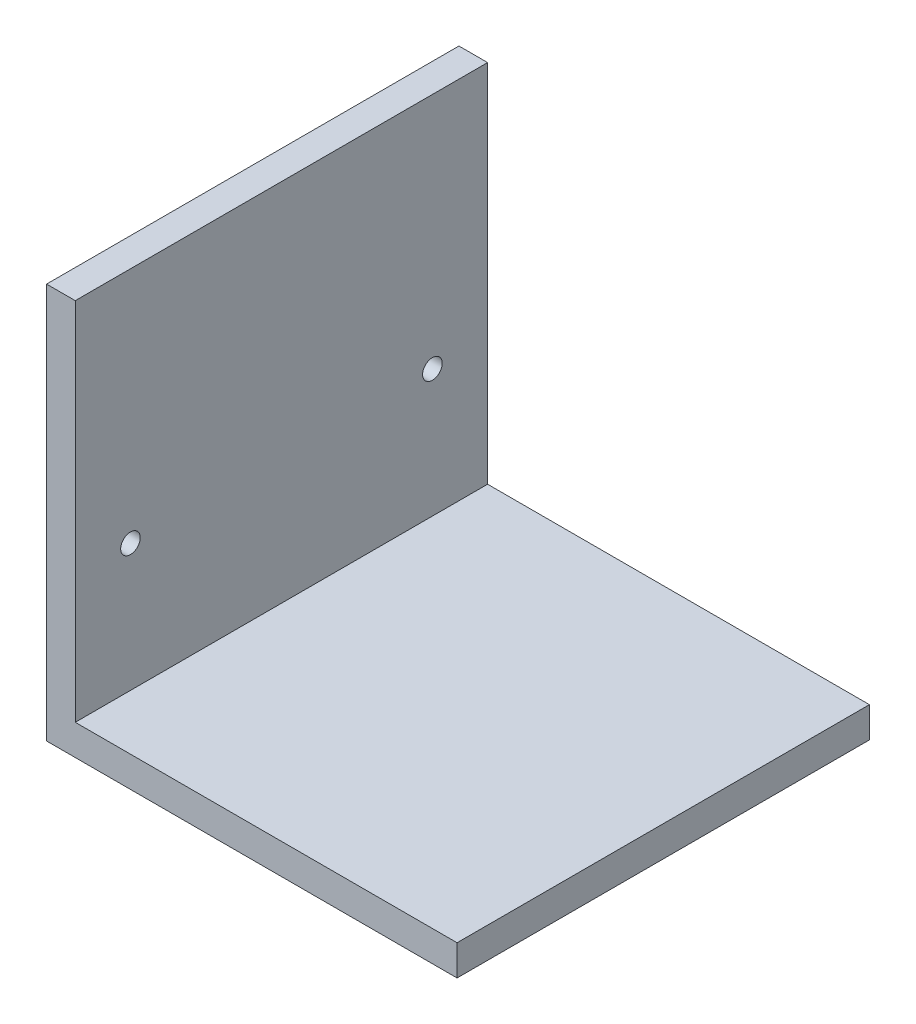
from build123d import *

# Parameters (mm, degrees)
SKETCH1_W           = 42.12
SKETCH1_H           = 40.42
BOSS_EXTRUDE1_DEPTH = 0.01
SKETCH2_W           = 42.12
SKETCH2_H           = 40.42
BOSS_EXTRUDE2_DEPTH = 2.92
SKETCH3_W           = 42.12
SKETCH3_H           = 3.12
BOSS_EXTRUDE3_DEPTH = 39
SKETCH4_R           = 1
CUT_EXTRUDE1_DEPTH  = 62.930807358
SKETCH5_R           = 9.087989047
CUT_EXTRUDE2_DEPTH  = 1


with BuildPart() as part:
    # Sketch1 → Boss-Extrude1 (new body)
    with BuildSketch(Plane(origin=(0, 0, 0), x_dir=(0, 0, -1), z_dir=(1, 0, 0))):
        with Locations((0, 20.21)):
            Rectangle(SKETCH1_W, SKETCH1_H)
    extrude(amount=BOSS_EXTRUDE1_DEPTH)

    # Sketch2 → Boss-Extrude2 (add)
    with BuildSketch(Plane(origin=(0.01, 0, 0), x_dir=(0, 0, -1), z_dir=(1, 0, 0))):
        with Locations((0, 20.21)):
            Rectangle(SKETCH2_W, SKETCH2_H)
    extrude(amount=BOSS_EXTRUDE2_DEPTH)

    # Sketch3 → Boss-Extrude3 (add)
    with BuildSketch(Plane(origin=(2.93, 0, 0), x_dir=(0, 0, -1), z_dir=(1, 0, 0))):
        with Locations((0, 1.56)):
            Rectangle(SKETCH3_W, SKETCH3_H)
    extrude(amount=BOSS_EXTRUDE3_DEPTH)

    # Sketch4 → Cut-Extrude1 (cut, through all)
    with BuildSketch(Plane.ZY):
        with Locations((15.42, 16.14)):
            Circle(SKETCH4_R)
        with Locations((-15.42, 16.14)):
            Circle(SKETCH4_R)
    extrude(amount=-CUT_EXTRUDE1_DEPTH, mode=Mode.SUBTRACT)

    # Sketch5 → Cut-Extrude2 (cut)
    with BuildSketch(Plane.XZ):
        with Locations(Location((25.93, 0, 0), (0, 0, 270))):
            Circle(SKETCH5_R)
    extrude(amount=-CUT_EXTRUDE2_DEPTH, mode=Mode.SUBTRACT)


solid = part.part
